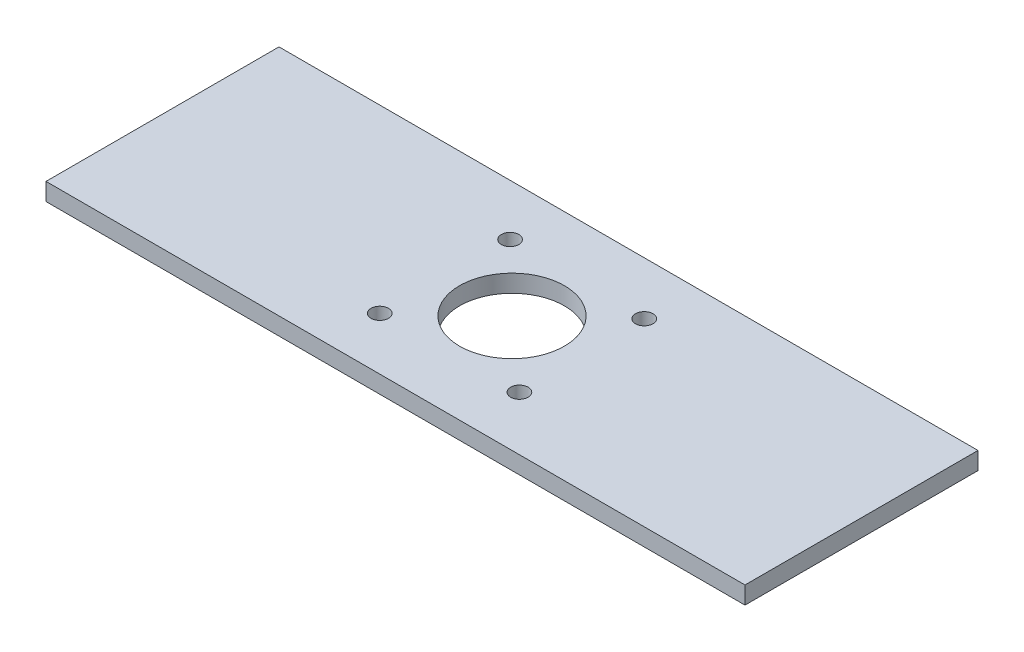
from build123d import *

# Parameters (mm, degrees)
SKETCH1_W                      = 190.5
SKETCH1_H                      = 63.5
BOSS_EXTRUDE1_DEPTH            = 4.7625
SKETCH3_R                      = 14.2875
CUT_EXTRUDE1_DEPTH             = 101.515204851
F_3_16_0_1875_DIAMETER_HOLE1_D = 4.7625


with BuildPart() as part:
    # Sketch1 → Boss-Extrude1 (new body)
    with BuildSketch(Plane(origin=(0, 0, 0), x_dir=(1, 0, 0), z_dir=(0, 1, 0))):
        Rectangle(SKETCH1_W, SKETCH1_H)
    extrude(amount=BOSS_EXTRUDE1_DEPTH)

    # Sketch3 → Cut-Extrude1 (cut, through all)
    with BuildSketch(Plane(origin=(0, 4.7625, 0), x_dir=(1, 0, 0), z_dir=(0, 1, 0))):
        with Locations(Location((0, 0, 0), (0, 0, 270))):
            Circle(SKETCH3_R)
    extrude(amount=-CUT_EXTRUDE1_DEPTH, mode=Mode.SUBTRACT)

    # 3/16 (0.1875) Diameter Hole1 (through all)
    with Locations(Plane(origin=(0, 4.7625, 0), x_dir=(1, 0, 0), z_dir=(0, 1, 0))):
        with Locations((-18.292133046, 17.768777988), (-18.629263442, -17.414997737), (18.68533355, 17.354823903), (19.013431756, -16.994734933)):
            Hole(F_3_16_0_1875_DIAMETER_HOLE1_D / 2)


solid = part.part
